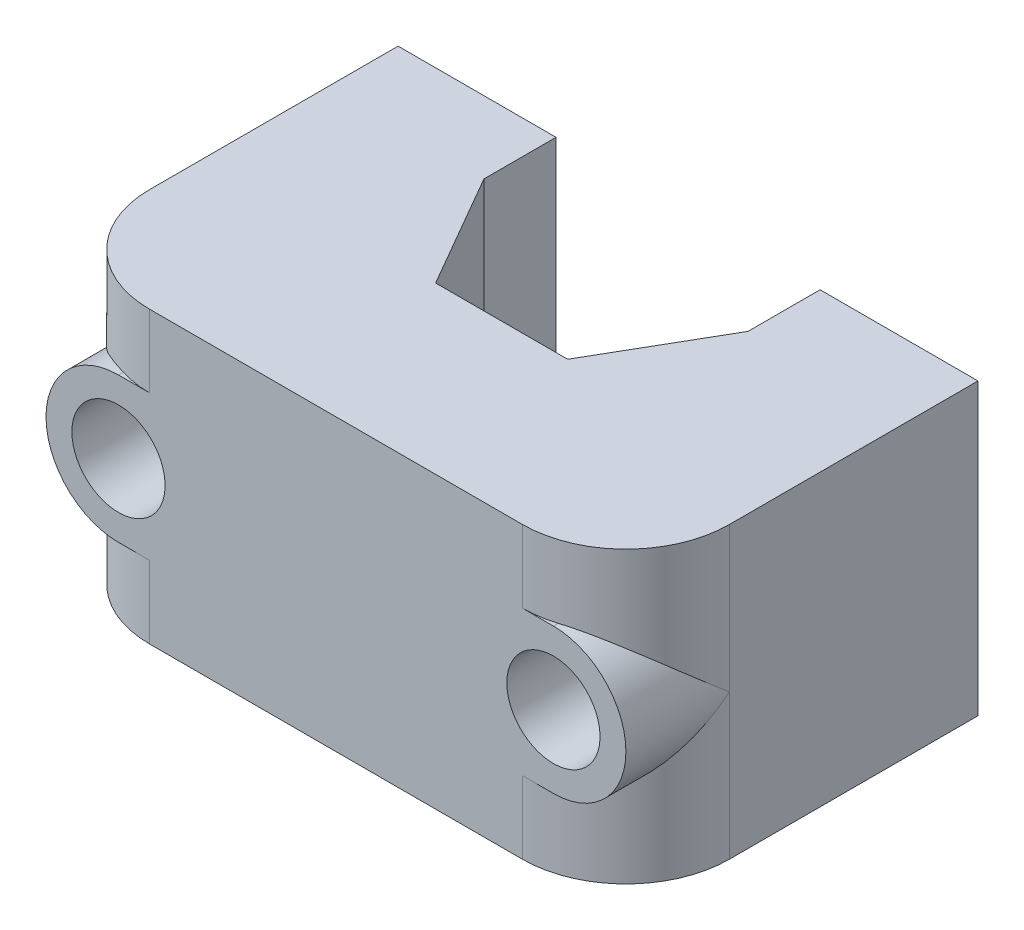
from build123d import *

# Parameters (mm, degrees)
SKETCH1_W           = 56
SKETCH1_H           = 34
BOSS_EXTRUDE1_DEPTH = 28
CUT_EXTRUDE1_DEPTH  = 18.6
CUT_EXTRUDE2_DEPTH  = 9.4
FILLET1_R           = 10
BOSS_EXTRUDE2_DEPTH = 16
SKETCH6_R           = 2.875
CUT_EXTRUDE3_DEPTH  = 34
SKETCH8_R           = 4.5
CUT_EXTRUDE4_DEPTH  = 24


with BuildPart() as part:
    # Sketch1 → Boss-Extrude1 (new body)
    with BuildSketch(Plane(origin=(0, 0, 0), x_dir=(1, 0, 0), z_dir=(0, 1, 0))):
        Rectangle(SKETCH1_W, SKETCH1_H)
    extrude(amount=BOSS_EXTRUDE1_DEPTH)

    # Sketch2 → Cut-Extrude1 (cut)
    with BuildSketch(Plane(origin=(0, 28, 0), x_dir=(1, 0, 0), z_dir=(0, 1, 0))):
        Polygon((-12.75, 10.041823898), (-6.375, -1), (6.375, -1), (12.75, 10.041823898), (12.75, 17), (-12.75, 17), align=None)
    extrude(amount=-CUT_EXTRUDE1_DEPTH, mode=Mode.SUBTRACT)

    # Sketch3 → Cut-Extrude2 (cut)
    with BuildSketch(Plane(origin=(0, 9.4, 0), x_dir=(1, 0, 0), z_dir=(0, 1, 0))):
        with BuildLine():
            Line((-11, 10), (-11, 17))
            Line((-11, 17), (11, 17))
            Line((11, 17), (11, 10))
            ThreePointArc((11, 10), (0, -1), (-11, 10))
        make_face()
    extrude(amount=-CUT_EXTRUDE2_DEPTH, mode=Mode.SUBTRACT)

    # Fillet1
    fillet1_edges = [part.edges().sort_by_distance(p)[0] for p in [
        (28, 14, 17),
        (-28, 14, 17),
    ]]
    fillet(fillet1_edges, radius=FILLET1_R)

    # Sketch5 → Boss-Extrude2 (add)
    with BuildSketch(Plane(origin=(0, 0, 1), x_dir=(-1, 0, 0), z_dir=(0, 0, -1))):
        with BuildLine():
            Line((18, 21), (18, 7))
            Line((18, 7), (21, 7))
            ThreePointArc((21, 7), (28, 14), (21, 21))
            Line((21, 21), (18, 21))
        make_face()
        with BuildLine():
            Line((-18, 7), (-21, 7))
            ThreePointArc((-21, 7), (-28, 14), (-21, 21))
            Line((-21, 21), (-18, 21))
            Line((-18, 21), (-18, 7))
        make_face()
    extrude(amount=-BOSS_EXTRUDE2_DEPTH)

    # Sketch6 → Cut-Extrude3 (cut)
    with BuildSketch(Plane.XY.offset(17)):
        with Locations((-21, 14)):
            Circle(SKETCH6_R)
        with Locations((21, 14)):
            Circle(SKETCH6_R)
    extrude(amount=-CUT_EXTRUDE3_DEPTH, mode=Mode.SUBTRACT)

    # Sketch8 → Cut-Extrude4 (cut)
    with BuildSketch(Plane(origin=(0, 0, -7), x_dir=(-1, 0, 0), z_dir=(0, 0, -1))):
        with Locations((21, 14)):
            Circle(SKETCH8_R)
        with Locations((-21, 14)):
            Circle(SKETCH8_R)
    extrude(amount=-CUT_EXTRUDE4_DEPTH, mode=Mode.SUBTRACT)


solid = part.part
